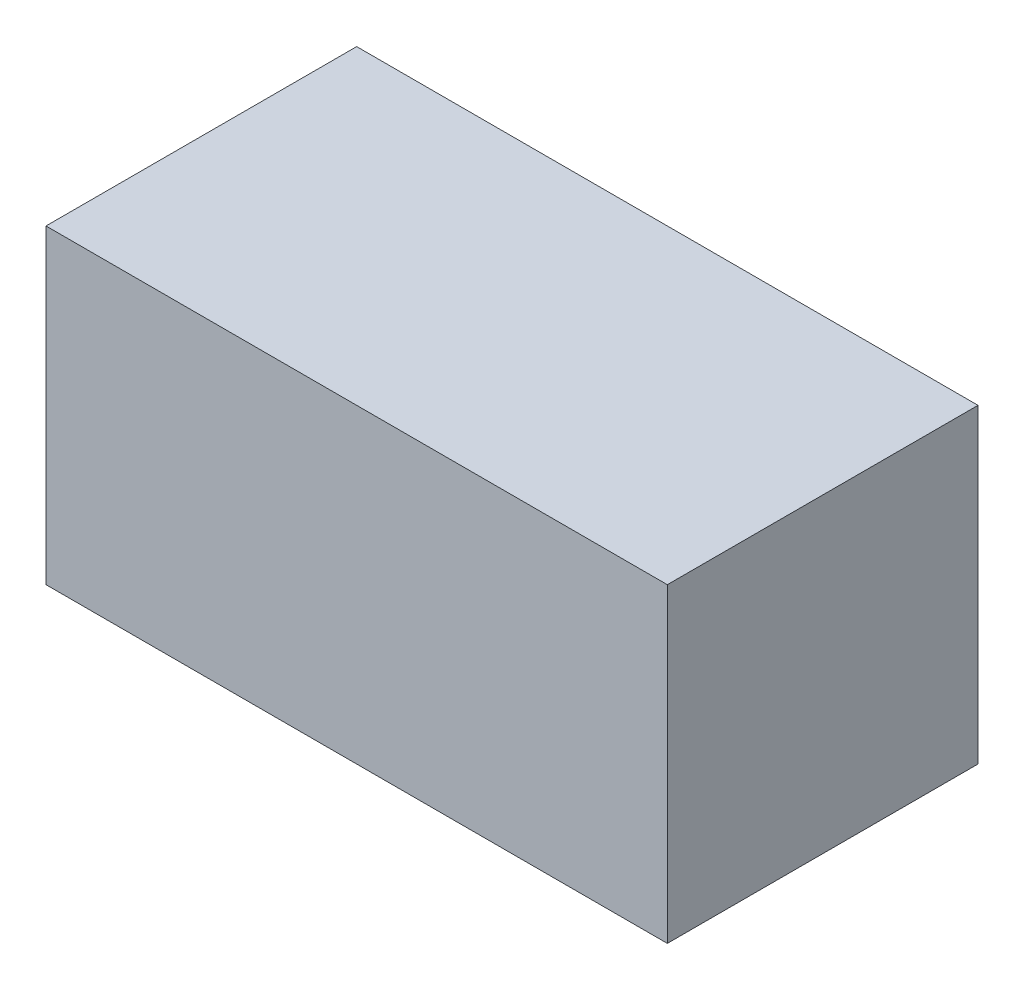
from build123d import *

# Parameters (mm, degrees)
BOSS_EXTRUDE1_START = 5
SKETCH1_W           = 20
SKETCH1_H           = 10
BOSS_EXTRUDE1_DEPTH = 10


with BuildPart() as part:
    # Sketch1 → Boss-Extrude1 (new body)
    with BuildSketch(Plane.XY.offset(BOSS_EXTRUDE1_START)):
        with Locations((10, 5)):
            Rectangle(SKETCH1_W, SKETCH1_H)
    extrude(amount=BOSS_EXTRUDE1_DEPTH)


solid = part.part
